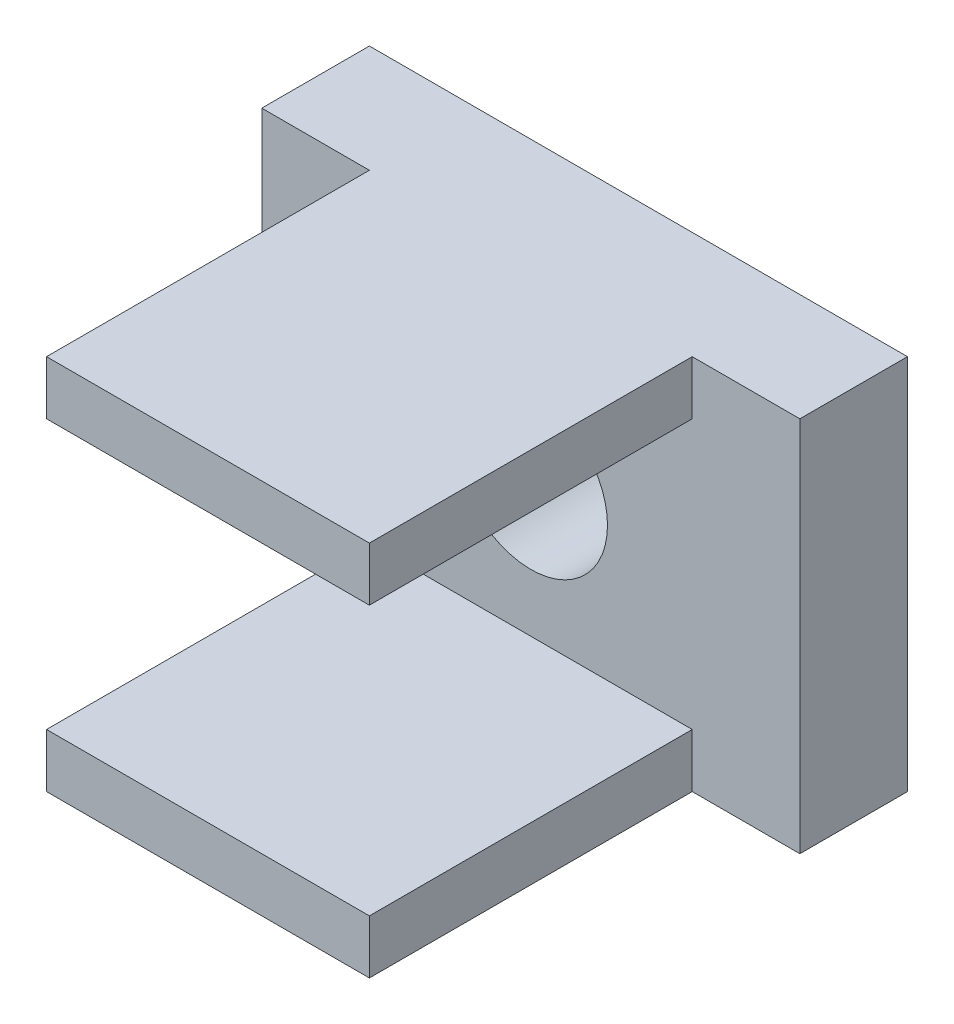
from build123d import *

# Parameters (mm, degrees)
SKETCH1_W           = 10
SKETCH1_H           = 7
BOSS_EXTRUDE1_DEPTH = 2
SKETCH2_W           = 6
SKETCH2_H           = 1
BOSS_EXTRUDE2_DEPTH = 6
SKETCH3_R           = 1.425
CUT_EXTRUDE1_DEPTH  = 9.558621384


with BuildPart() as part:
    # Sketch1 → Boss-Extrude1 (new body)
    with BuildSketch(Plane.XY):
        Rectangle(SKETCH1_W, SKETCH1_H)
    extrude(amount=BOSS_EXTRUDE1_DEPTH)

    # Sketch2 → Boss-Extrude2 (add)
    with BuildSketch(Plane.XY.offset(2)):
        with Locations((0, 3)):
            Rectangle(SKETCH2_W, SKETCH2_H)
        with Locations((0, -3)):
            Rectangle(SKETCH2_W, SKETCH2_H)
    extrude(amount=BOSS_EXTRUDE2_DEPTH)

    # Sketch3 → Cut-Extrude1 (cut, through all)
    with BuildSketch(Plane.XY.offset(2)):
        Circle(SKETCH3_R)
    extrude(amount=-CUT_EXTRUDE1_DEPTH, mode=Mode.SUBTRACT)


solid = part.part
